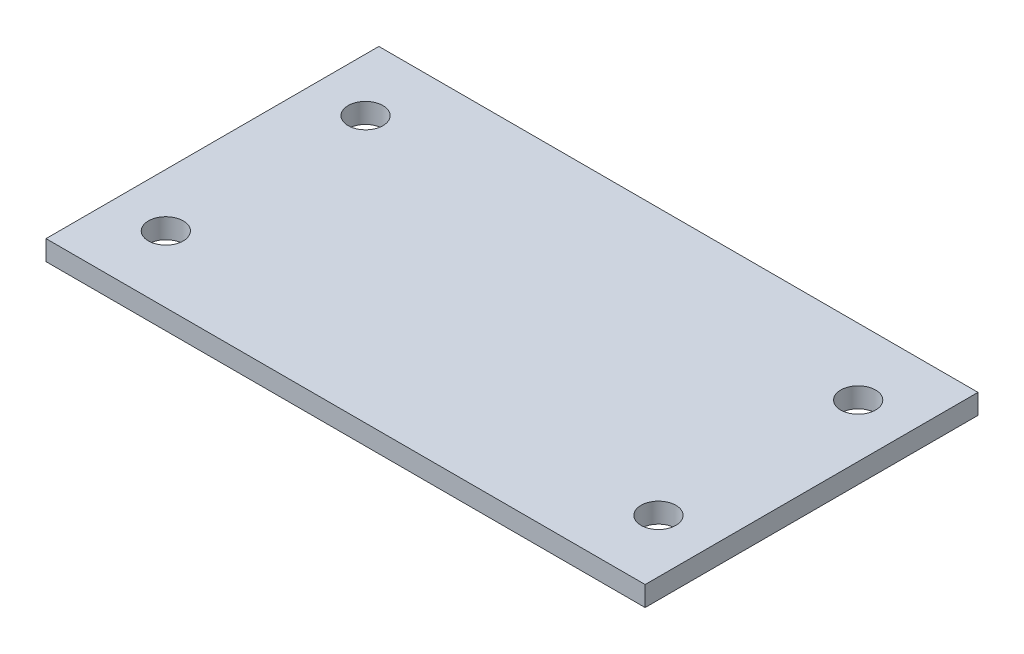
from build123d import *

# Parameters (mm, degrees)
SKETCH_1_W               = 90
SKETCH_1_H               = 50
EXTRUDE_1_DEPTH          = 3
CUT_EXTRUDE_2_DEPTH      = 3
CUT_EXTRUDE_2_DEPTH_BACK = 52.565492337
SKETCH_2_R               = 2.61676391


with BuildPart() as part:
    # 草图1 → 凸台-拉伸1 (new body)
    with BuildSketch(Plane(origin=(0, 0, 0), x_dir=(1, 0, 0), z_dir=(0, 1, 0))):
        Rectangle(SKETCH_1_W, SKETCH_1_H)
    extrude(amount=EXTRUDE_1_DEPTH)

    # 草图2 → 切除-拉伸2 (cut, two sides: drawn at the far end of the back side and taken through both)
    with BuildSketch(Plane(origin=(0, 0, 0), x_dir=(1, 0, 0), z_dir=(0, 1, 0)).offset(-CUT_EXTRUDE_2_DEPTH_BACK)):
        with Locations(Location((-37, 15, 0), (0, 0, 270))):
            Circle(SKETCH_2_R)
        with Locations(Location((-37, -15, 0), (0, 0, 270))):
            Circle(SKETCH_2_R)
        with Locations(Location((37, -15, 0), (0, 0, 270))):
            Circle(SKETCH_2_R)
        with Locations(Location((37, 15, 0), (0, 0, 270))):
            Circle(SKETCH_2_R)
    extrude(amount=CUT_EXTRUDE_2_DEPTH + CUT_EXTRUDE_2_DEPTH_BACK, mode=Mode.SUBTRACT)


solid = part.part
